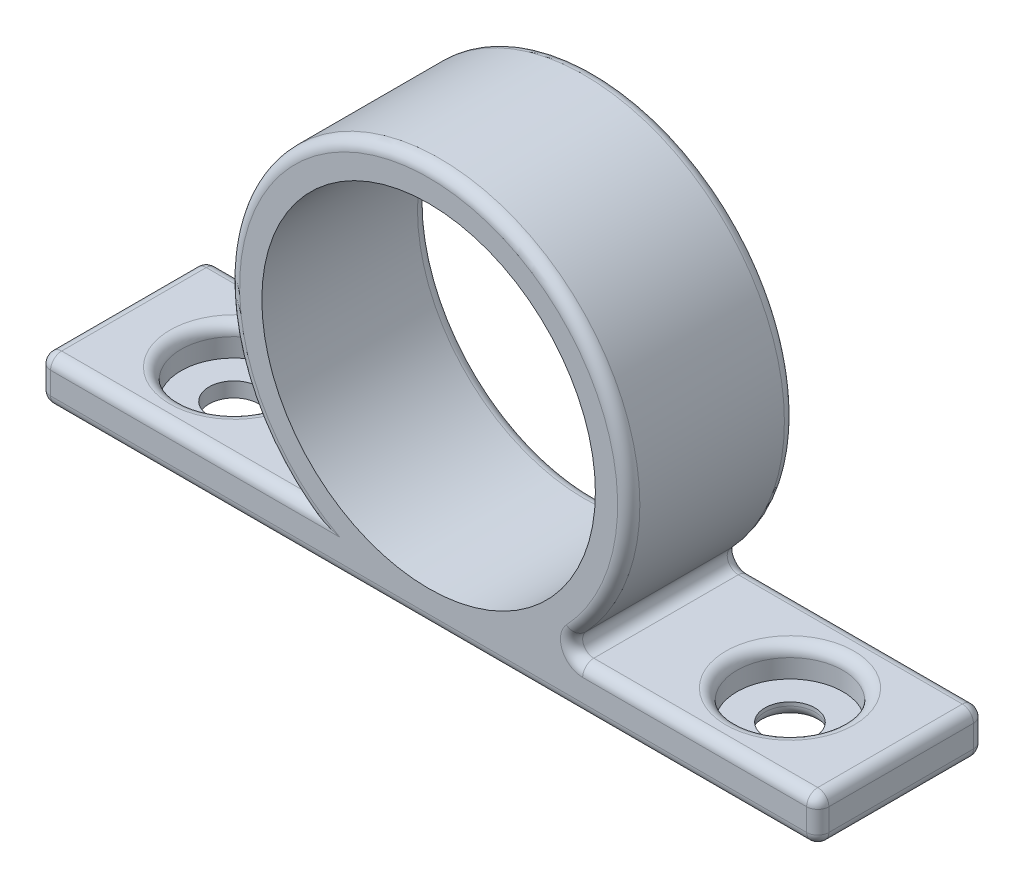
from build123d import *

# Parameters (mm, degrees)
SKETCH1_R                                           = 15
BOSS_EXTRUDE1_DEPTH                                 = 7.5
CBORE_FOR_8_BINDING_HEAD_MACHINE_SCREW1_D           = 4.4958
CBORE_FOR_8_BINDING_HEAD_MACHINE_SCREW1_DEPTH       = 10
CBORE_FOR_8_BINDING_HEAD_MACHINE_SCREW1_CBORE_D     = 9.525
CBORE_FOR_8_BINDING_HEAD_MACHINE_SCREW1_CBORE_DEPTH = 2.667
CBORE_FOR_8_BINDING_HEAD_MACHINE_SCREW1_TIP         = 1.350674586
FILLET1_R                                           = 1


with BuildPart() as part:
    # Sketch1 → Boss-Extrude1 (new, symmetric)
    with BuildSketch(Plane.XY):
        with BuildLine():
            Line((-35, 0), (-35, 4))
            Line((-35, 4), (-11.313708499, 4))
            ThreePointArc((-11.313708499, 4), (0, 36), (11.313708499, 4))
            Line((11.313708499, 4), (35, 4))
            Line((35, 4), (35, 0))
            Line((35, 0), (-35, 0))
        make_face()
        with Locations((0, 18)):
            Circle(SKETCH1_R, mode=Mode.SUBTRACT)
    extrude(amount=BOSS_EXTRUDE1_DEPTH, both=True)

    # CBORE for #8 Binding Head Machine Screw1
    with Locations(Plane(origin=(0, 4, 0), x_dir=(1, 0, 0), z_dir=(0, 1, 0))):
        with Locations((-25, 0), (25, 0)):
            CounterBoreHole(CBORE_FOR_8_BINDING_HEAD_MACHINE_SCREW1_D / 2, CBORE_FOR_8_BINDING_HEAD_MACHINE_SCREW1_CBORE_D / 2, CBORE_FOR_8_BINDING_HEAD_MACHINE_SCREW1_CBORE_DEPTH, depth=CBORE_FOR_8_BINDING_HEAD_MACHINE_SCREW1_DEPTH)
            with Locations((0, 0, -(CBORE_FOR_8_BINDING_HEAD_MACHINE_SCREW1_DEPTH + CBORE_FOR_8_BINDING_HEAD_MACHINE_SCREW1_TIP / 2))):  # 118° drill point
                Cone(0, CBORE_FOR_8_BINDING_HEAD_MACHINE_SCREW1_D / 2, CBORE_FOR_8_BINDING_HEAD_MACHINE_SCREW1_TIP, mode=Mode.SUBTRACT)

    # Fillet1
    fillet1_edges = [part.edges().sort_by_distance(p)[0] for p in [
        (-35, 0, 0),
        (-35, 4, 0),
        (11.313708499, 4, 0),
        (35, 4, 0),
        (35, 0, 0),
        (23.156854249, 4, 7.5),
        (0, 36, 7.5),
        (-15, 18, -7.5),
        (-23.156854249, 4, 7.5),
        (-35, 2, 7.5),
        (27.2479, 0, 0),
        (20.2375, 4, 0),
        (-29.7625, 4, 0),
        (0, 0, 7.5),
        (-35, 2, -7.5),
        (-23.156854249, 4, -7.5),
        (0, 36, -7.5),
        (23.156854249, 4, -7.5),
        (35, 2, -7.5),
        (0, 0, -7.5),
        (35, 2, 7.5),
    ]]
    fillet(fillet1_edges, radius=FILLET1_R)


solid = part.part
